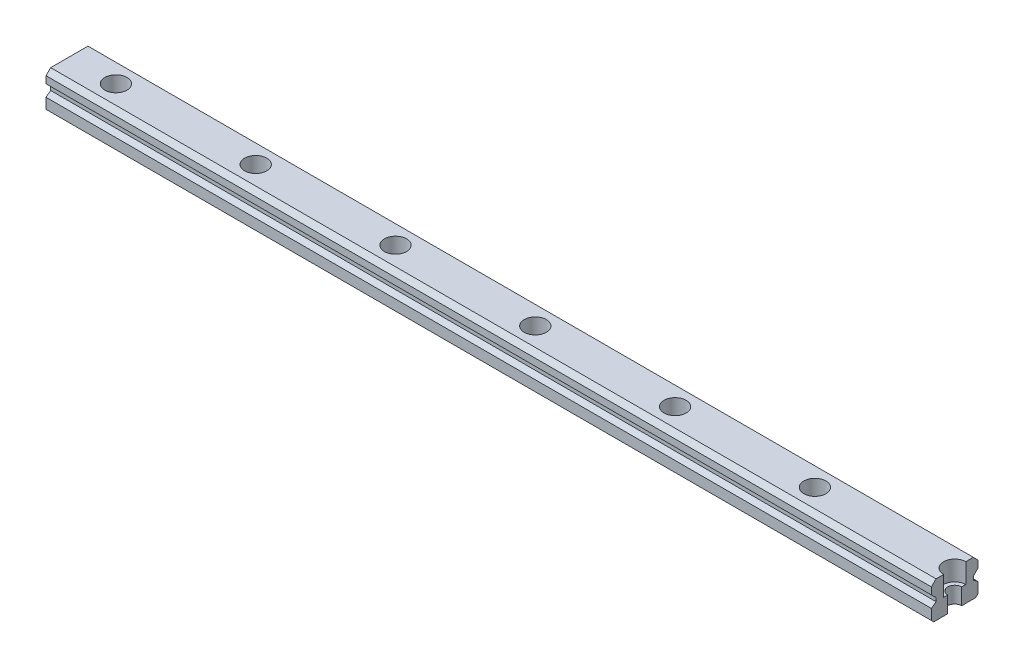
from build123d import *

# Parameters (mm, degrees)
BOSS_EXTRUDE1_DEPTH = 380
SKETCH2_R           = 4.75
CUT_EXTRUDE1_DEPTH  = 8.5
SKETCH3_R           = 3
CUT_EXTRUDE2_DEPTH  = 381.226577188
LPATTERN1_COUNT     = 33
LPATTERN1_PITCH     = 60


with BuildPart() as part:
    # Sketch1 → Boss-Extrude1 (new body)
    with BuildSketch(Plane(origin=(0, 0, 0), x_dir=(0, 0, -1), z_dir=(1, 0, 0))):
        Polygon((9, 0), (-9, 0), (-10, 1), (-10, 5.5), (-8, 7), (-8, 8.5), (-10, 10.5), (-10, 13.5), (-8, 15.5), (8, 15.5), (10, 13.5), (10, 10.5), (8, 8.5), (8, 7), (10, 5.5), (10, 1), align=None)
    extrude(amount=BOSS_EXTRUDE1_DEPTH)

    # Sketch2 → Cut-Extrude1 (cut)
    with BuildSketch(Plane(origin=(0, 15.5, 0), x_dir=(1, 0, 0), z_dir=(0, 1, 0))):
        with Locations(Location((20, 0, 0), (0, 0, 270))):
            Circle(SKETCH2_R)
    cut_extrude1 = extrude(amount=-CUT_EXTRUDE1_DEPTH, mode=Mode.SUBTRACT)

    # Sketch3 → Cut-Extrude2 (cut, through all)
    with BuildSketch(Plane(origin=(0, 7, 0), x_dir=(1, 0, 0), z_dir=(0, 1, 0))):
        with Locations(Location((20, 0, 0), (0, 0, 270))):
            Circle(SKETCH3_R)
    cut_extrude2 = extrude(amount=-CUT_EXTRUDE2_DEPTH, mode=Mode.SUBTRACT)

    # LPattern1: Cut-Extrude1, Cut-Extrude2 ×33
    with Locations(*[(i * LPATTERN1_PITCH, 0, 0) for i in range(1, LPATTERN1_COUNT)]):
        add(cut_extrude1, mode=Mode.SUBTRACT)
        add(cut_extrude2, mode=Mode.SUBTRACT)


solid = part.part
